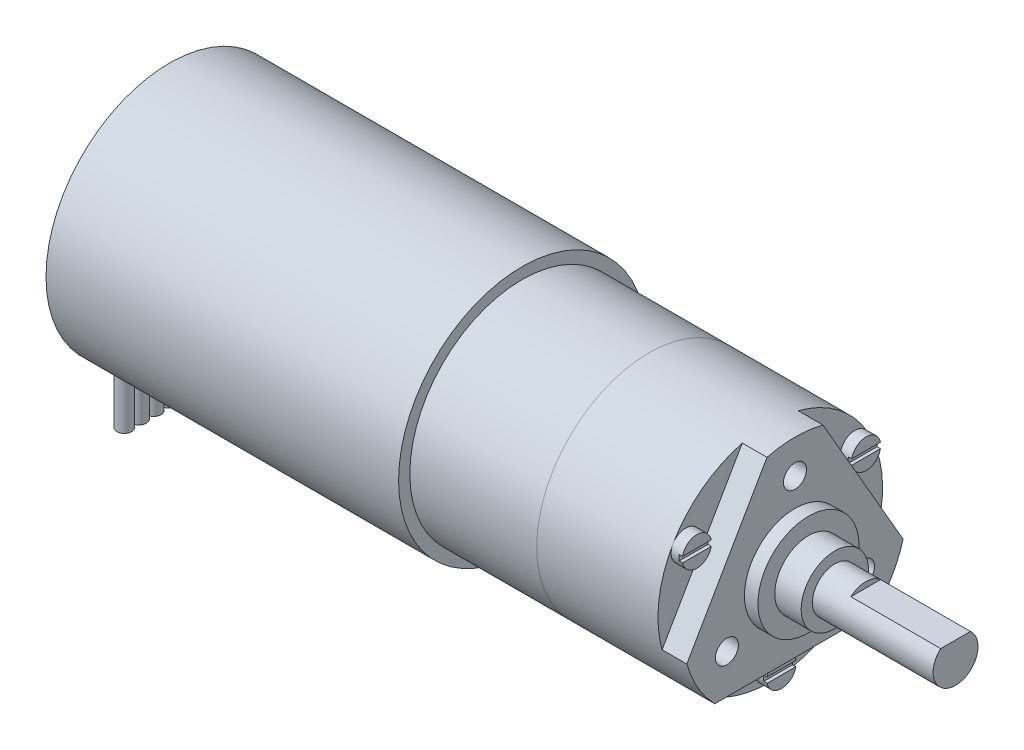
from build123d import *

# Parameters (mm, degrees)
TROU_TARAUD_M2_51_D          = 2.05
TROU_TARAUD_M2_51_DEPTH      = 4.35
TROU_TARAUD_M2_51_TIP        = 0.615882135
ENL_V_START                  = -2.2
ENL_V_MAT_EXTRU_1_DEPTH      = 2.2
ESQUISSE5_R                  = 1.3
BOSS_EXTRU_1_DEPTH           = 1
ESQUISSE6_W                  = 2.6
ESQUISSE6_H                  = 0.5
ENL_V_MAT_EXTRU_2_DEPTH      = 0.3
ENL_V_MAT_EXTRU_3_DEPTH      = 72.707740168
ENL_V_MAT_EXTRU_3_DEPTH_BACK = 72.707740168
ESQUISSE7_W                  = 8
ESQUISSE7_H                  = 0.5
BOSS_EXTRU_2_DEPTH           = 2.4
ESQUISSE9_R                  = 0.65
BOSS_EXTRU_3_DEPTH           = 10


with BuildPart() as part:
    # Esquisse1 → Révolution1 (revolve)
    with BuildSketch(Plane.XY, mode=Mode.PRIVATE) as r_volution1_sk:
        Polygon((70, 0), (70, 2), (59.25, 2), (59.25, 3), (56.9, 3), (56.9, 4.5), (55.7, 4.5), (55.7, 10), (31.4, 10), (31.4, 11), (0, 11), (0, 0), align=None)
    revolve(r_volution1_sk.sketch.rotate(Axis((0, 0, 0), (1, 0, 0)), 90), axis=Axis((0, 0, 0), (1, 0, 0)))

    # Trou taraudé M2.51
    with Locations(Plane(origin=(55.7, 0, 0), x_dir=(0, 0, -1), z_dir=(1, 0, 0))):
        with Locations((0, 7), (-6.062177826, -3.5), (6.062177826, -3.5)):
            Hole(TROU_TARAUD_M2_51_D / 2, depth=TROU_TARAUD_M2_51_DEPTH)
            with Locations((0, 0, -(TROU_TARAUD_M2_51_DEPTH + TROU_TARAUD_M2_51_TIP / 2))):  # 118° drill point
                Cone(0, TROU_TARAUD_M2_51_D / 2, TROU_TARAUD_M2_51_TIP, mode=Mode.SUBTRACT)

    # Esquisse4 → Enlèv. mat.-Extru.1 (cut)
    with BuildSketch(Plane(origin=(55.7, 0, 0), x_dir=(0, 0, -1), z_dir=(1, 0, 0)).offset(ENL_V_START)):
        with BuildLine():
            Line((-9.632892041, -2.684658438), (-2.491463612, 9.684658438))
            ThreePointArc((-2.491463612, 9.684658438), (-8.660254038, 5), (-9.632892041, -2.684658438))
        make_face()
        with BuildLine():
            Line((0, -7), (-7.141428429, -7))
            ThreePointArc((-7.141428429, -7), (-3.872983346, -9.219544457), (0, -10))
            Line((0, -10), (0, -7))
        make_face()
        with BuildLine():
            ThreePointArc((0, -10), (3.872983346, -9.219544457), (7.141428429, -7))
            Line((7.141428429, -7), (0, -7))
            Line((0, -7), (0, -10))
        make_face()
        with BuildLine():
            ThreePointArc((10, 0), (7.902994247, 6.127208332), (2.491463612, 9.684658438))
            Line((2.491463612, 9.684658438), (9.632892041, -2.684658438))
            ThreePointArc((9.632892041, -2.684658438), (9.907797949, -1.354820946), (10, 0))
        make_face()
    extrude(amount=ENL_V_MAT_EXTRU_1_DEPTH, mode=Mode.SUBTRACT)

    # Esquisse5 → Boss.-Extru.1 (add)
    with BuildSketch(Plane(origin=(53.5, 0, 0), x_dir=(0, 0, -1), z_dir=(1, 0, 0))):
        with Locations(Location((-7.534421013, 4.35, 0), (0, 0, 149.999238117))):
            Circle(ESQUISSE5_R)
        with Locations(Location((7.534421013, 4.35, 0), (0, 0, 29.999238117))):
            Circle(ESQUISSE5_R)
        with Locations(Location((0, -8.7, 0), (0, 0, 269.999238081))):
            Circle(ESQUISSE5_R)
    extrude(amount=BOSS_EXTRU_1_DEPTH)

    # Esquisse6 → Enlèv. mat.-Extru.2 (cut)
    with BuildSketch(Plane(origin=(54.5, 0, 0), x_dir=(0, 0, -1), z_dir=(1, 0, 0))):
        with Locations((-7.534421013, 4.35)):
            Rectangle(ESQUISSE6_W, ESQUISSE6_H)
        with Locations((7.534421013, 4.35)):
            Rectangle(ESQUISSE6_W, ESQUISSE6_H)
        with Locations((0, -8.7)):
            Rectangle(ESQUISSE6_W, ESQUISSE6_H)
    extrude(amount=-ENL_V_MAT_EXTRU_2_DEPTH, mode=Mode.SUBTRACT)

    # Esquisse7 → Enlèv. mat.-Extru.3 (cut, two sides: drawn at the far end of the back side and taken through both)
    with BuildSketch(Plane.XY.offset(-ENL_V_MAT_EXTRU_3_DEPTH_BACK)):
        with Locations((66, 1.75)):
            Rectangle(ESQUISSE7_W, ESQUISSE7_H)
    extrude(amount=ENL_V_MAT_EXTRU_3_DEPTH + ENL_V_MAT_EXTRU_3_DEPTH_BACK, mode=Mode.SUBTRACT)

    # Esquisse8 → Boss.-Extru.2 (add)
    with BuildSketch(Plane.ZY):
        with BuildLine():
            Line((-4.613025038, -5.85), (4.613025038, -5.85))
            ThreePointArc((4.613025038, -5.85), (0, 7.45), (-4.613025038, -5.85))
        make_face()
    extrude(amount=BOSS_EXTRU_2_DEPTH)

    # Esquisse9 → Boss.-Extru.3 (add)
    with BuildSketch(Plane.XZ.offset(5.85)):
        with Locations(Location((-0.75, 3.275, 0), (0, 0, 90))):
            Circle(ESQUISSE9_R)
        with Locations(Location((-0.75, 1.965, 0), (0, 0, 90))):
            Circle(ESQUISSE9_R)
        with Locations(Location((-0.75, 0.655, 0), (0, 0, 90))):
            Circle(ESQUISSE9_R)
        with Locations(Location((-0.75, -0.655, 0), (0, 0, 90))):
            Circle(ESQUISSE9_R)
        with Locations(Location((-0.75, -1.965, 0), (0, 0, 90))):
            Circle(ESQUISSE9_R)
        with Locations(Location((-0.75, -3.275, 0), (0, 0, 90))):
            Circle(ESQUISSE9_R)
    extrude(amount=BOSS_EXTRU_3_DEPTH)


solid = part.part
